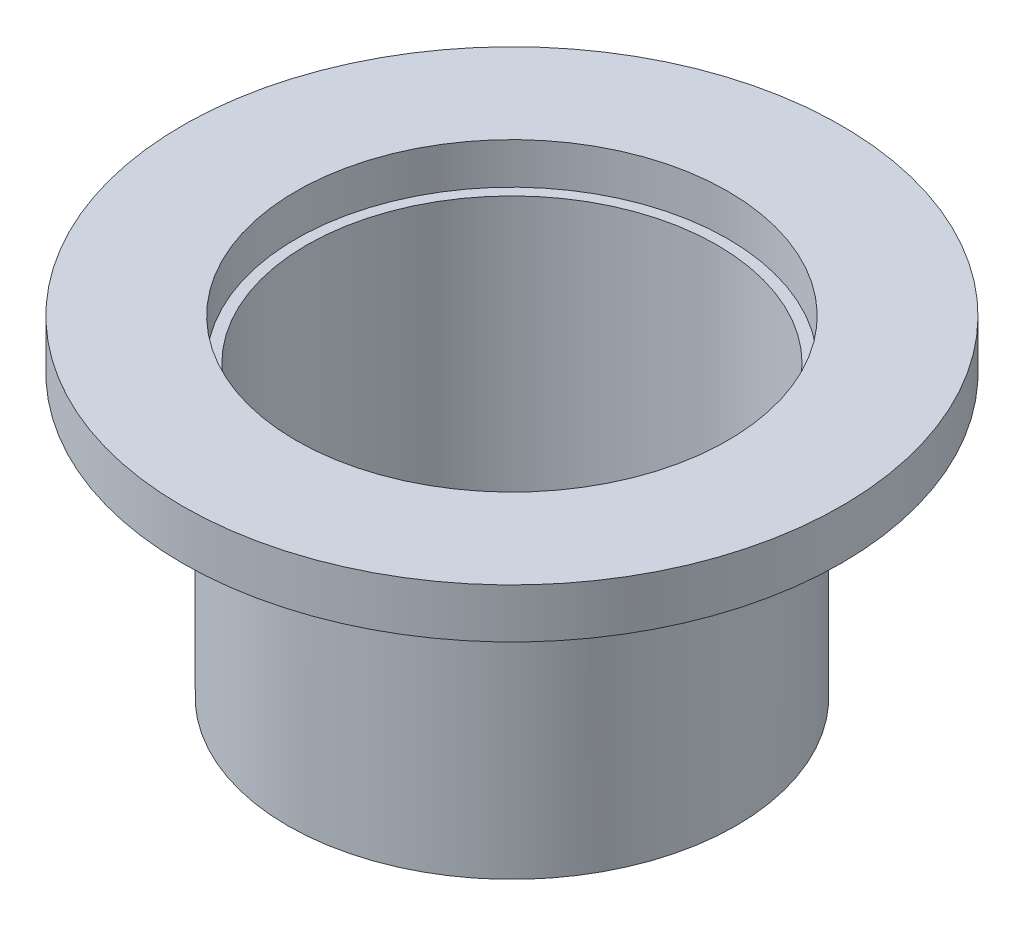
from build123d import *

# Parameters (mm, degrees)
SKETCH_1_R          = 13.6
SKETCH_1_R_2        = 12.45
EXTRUDE_1_DEPTH     = 20
SKETCH_2_R          = 20
EXTRUDE_2_DEPTH     = 5
SKETCH_3_R          = 13.1
CUT_EXTRUDE_1_DEPTH = 2.5
SKETCH_4_R          = 12.45
CUT_EXTRUDE_2_DEPTH = 10


with BuildPart() as part:
    # 草图1 → 凸台-拉伸1 (new body)
    with BuildSketch(Plane(origin=(0, 0, 0), x_dir=(1, 0, 0), z_dir=(0, 1, 0))):
        with Locations(Location((0, 0, 0), (0, 0, 270))):
            Circle(SKETCH_1_R)
        with Locations(Location((0, 0, 0), (0, 0, 270))):
            Circle(SKETCH_1_R_2, mode=Mode.SUBTRACT)
    extrude(amount=EXTRUDE_1_DEPTH)

    # 草图2 → 凸台-拉伸2 (add)
    with BuildSketch(Plane(origin=(0, 20, 0), x_dir=(1, 0, 0), z_dir=(0, 1, 0))):
        with Locations(Location((0, 0, 0), (0, 0, 270))):
            Circle(SKETCH_2_R)
    extrude(amount=-EXTRUDE_2_DEPTH)

    # 草图3 → 切除-拉伸1 (cut)
    with BuildSketch(Plane(origin=(0, 20, 0), x_dir=(1, 0, 0), z_dir=(0, 1, 0))):
        with Locations(Location((0, 0, 0), (0, 0, 270))):
            Circle(SKETCH_3_R)
    extrude(amount=-CUT_EXTRUDE_1_DEPTH, mode=Mode.SUBTRACT)

    # 草图4 → 切除-拉伸2 (cut)
    with BuildSketch(Plane.XZ.offset(-15)):
        with Locations(Location((0, 0, 0), (0, 0, 90))):
            Circle(SKETCH_4_R)
    extrude(amount=-CUT_EXTRUDE_2_DEPTH, mode=Mode.SUBTRACT)

    # 草图5 → 切除-旋转2 (revolve, cut)
    with BuildSketch(Plane(origin=(0, 0, 0), x_dir=(0, 0, -1), z_dir=(1, 0, 0))):
        Polygon((20, 17), (13.6, 15), (20, 15), align=None)
    revolve(axis=Axis((0, 0, 0), (0, 1, 0)), mode=Mode.SUBTRACT)


solid = part.part
